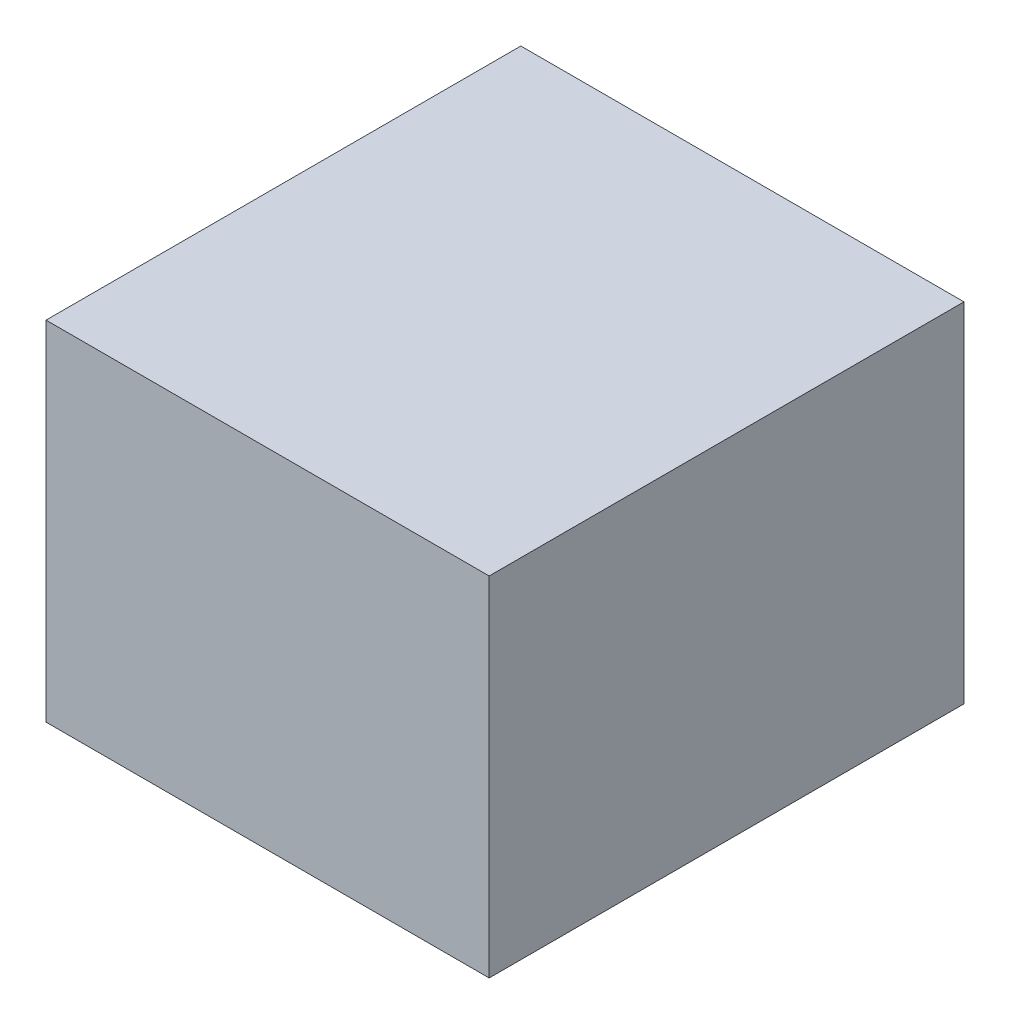
from build123d import *

# Parameters (mm, degrees)
CROQUIS1_W              = 28
CROQUIS1_H              = 22
SALIENTE_EXTRUIR1_DEPTH = 15


with BuildPart() as part:
    # Croquis1 → Saliente-Extruir1 (new, symmetric)
    with BuildSketch(Plane.XY):
        Rectangle(CROQUIS1_W, CROQUIS1_H)
    extrude(amount=SALIENTE_EXTRUIR1_DEPTH, both=True)


solid = part.part
